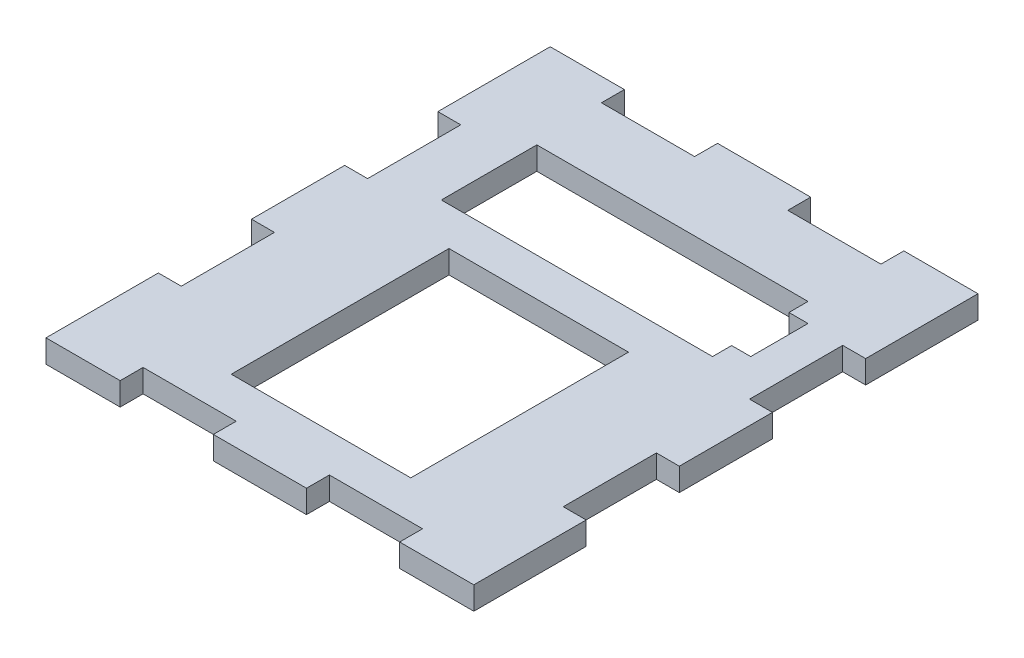
from build123d import *

# Parameters (mm, degrees)
BOSS_EXTRUDE1_DEPTH = 6
SKETCH2_W           = 71
SKETCH2_H           = 25
SKETCH2_W_2         = 5
SKETCH2_H_2         = 15
SKETCH2_W_3         = 47
SKETCH2_H_3         = 57
CUT_EXTRUDE1_DEPTH  = 176.513532242


with BuildPart() as part:
    # Sketch1 → Boss-Extrude1 (new body)
    with BuildSketch(Plane(origin=(0, 0, 0), x_dir=(1, 0, 0), z_dir=(0, 1, 0))):
        Polygon((0, 135), (0, 105.585), (6, 105.585), (6, 81.195), (0, 81.195), (0, 56.805), (6, 56.805), (6, 32.415), (0, 32.415), (0, 8.025), (0, 3), (19.415, 3), (19.415, 9), (43.805, 9), (43.805, 3), (68.195, 3), (68.195, 9), (92.585, 9), (92.585, 3), (112, 3), (112, 32.415), (106, 32.415), (106, 56.805), (112, 56.805), (112, 81.195), (106, 81.195), (106, 105.585), (112, 105.585), (112, 129.975), (112, 135), (92.585, 135), (92.585, 129), (68.195, 129), (68.195, 135), (43.805, 135), (43.805, 129), (19.415, 129), (19.415, 135), align=None)
    extrude(amount=BOSS_EXTRUDE1_DEPTH)

    # Sketch2 → Cut-Extrude1 (cut, through all)
    with BuildSketch(Plane(origin=(0, 6, 0), x_dir=(1, 0, 0), z_dir=(0, 1, 0))):
        with Locations((56, 98.5)):
            Rectangle(SKETCH2_W, SKETCH2_H)
        with Locations((94, 98.5)):
            Rectangle(SKETCH2_W_2, SKETCH2_H_2)
        with Locations((56, 47.5)):
            Rectangle(SKETCH2_W_3, SKETCH2_H_3)
    extrude(amount=-CUT_EXTRUDE1_DEPTH, mode=Mode.SUBTRACT)


solid = part.part
